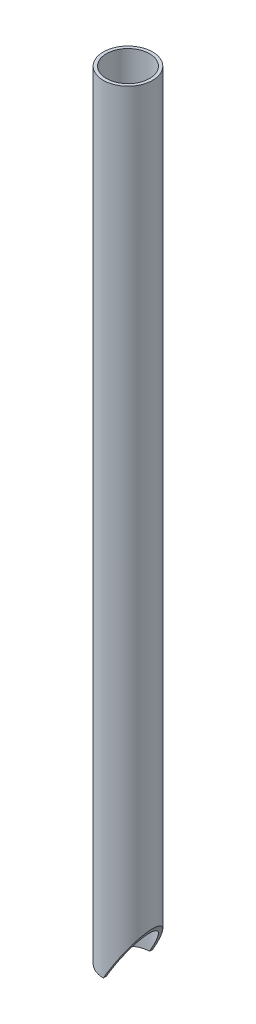
from build123d import *

# Parameters (mm, degrees)
SKETCH1_R               = 8
SKETCH1_R_2             = 7
BOSS_EXTRUDE1_DEPTH     = 252.432034356
CUT_EXTRUDE1_DEPTH      = 272.58
CUT_EXTRUDE1_DEPTH_BACK = 272.58


with BuildPart() as part:
    # Sketch1 → Boss-Extrude1 (new body)
    with BuildSketch(Plane(origin=(0, 0, 0), x_dir=(1, 0, 0), z_dir=(0, 1, 0))):
        Circle(SKETCH1_R)
        Circle(SKETCH1_R_2, mode=Mode.SUBTRACT)
    extrude(amount=BOSS_EXTRUDE1_DEPTH)

    # Sketch2 → Cut-Extrude1 (cut, two sides: drawn at the far end of the back side and taken through both)
    with BuildSketch(Plane.XY.offset(-CUT_EXTRUDE1_DEPTH_BACK)):
        Polygon((0, 0), (8, 13.856406461), (8, 0), align=None)
    extrude(amount=CUT_EXTRUDE1_DEPTH + CUT_EXTRUDE1_DEPTH_BACK, mode=Mode.SUBTRACT)


solid = part.part
